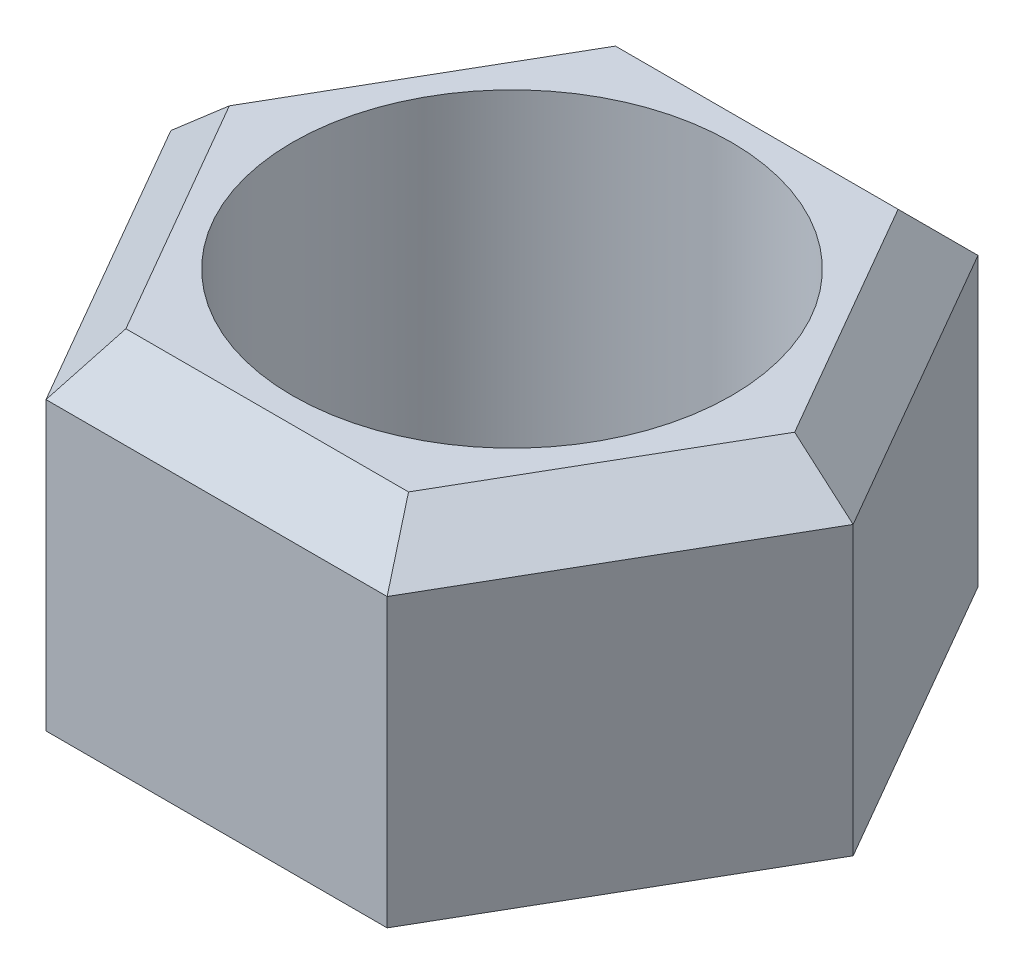
from build123d import *

# Parameters (mm, degrees)
BOSS_EXTRUDE1_DEPTH = 0.2
CUT_EXTRUDE1_REACH  = 2.334
SKETCH3_R           = 0.13
CHAMFER2_SIZE       = 0.03


with BuildPart() as part:
    # Sketch1 → Boss-Extrude1 (new body)
    with BuildSketch(Plane(origin=(0, 0, 0), x_dir=(1, 0, 0), z_dir=(0, 1, 0))):
        Polygon((0.101036297, 0.175), (-0.101036297, 0.175), (-0.202072594, 0), (-0.101036297, -0.175), (0.101036297, -0.175), (0.202072594, 0), align=None)
    extrude(amount=BOSS_EXTRUDE1_DEPTH)

    # Sketch3 → Cut-Extrude1 (cut, up to next)
    with BuildSketch(Plane.XZ, mode=Mode.PRIVATE) as cut_extrude1_sk1:
        with Locations(Location((0, 0, 0), (0, 0, 270))):
            Circle(SKETCH3_R)
    cut_extrude1_tool1 = extrude(cut_extrude1_sk1.sketch, amount=-CUT_EXTRUDE1_REACH, mode=Mode.PRIVATE) & part.part
    add(cut_extrude1_tool1.solids().sort_by_distance((0, 0, 0))[0], mode=Mode.SUBTRACT)

    # Chamfer2
    chamfer2_edges = [part.edges().sort_by_distance(p)[0] for p in [
        (-0.151554446, 0.2, -0.0875),
        (-0.151554446, 0.2, 0.0875),
        (0, 0.2, 0.175),
        (0.151554446, 0.2, 0.0875),
        (0.151554446, 0.2, -0.0875),
        (0, 0.2, -0.175),
    ]]
    chamfer(chamfer2_edges, length=CHAMFER2_SIZE)


solid = part.part
